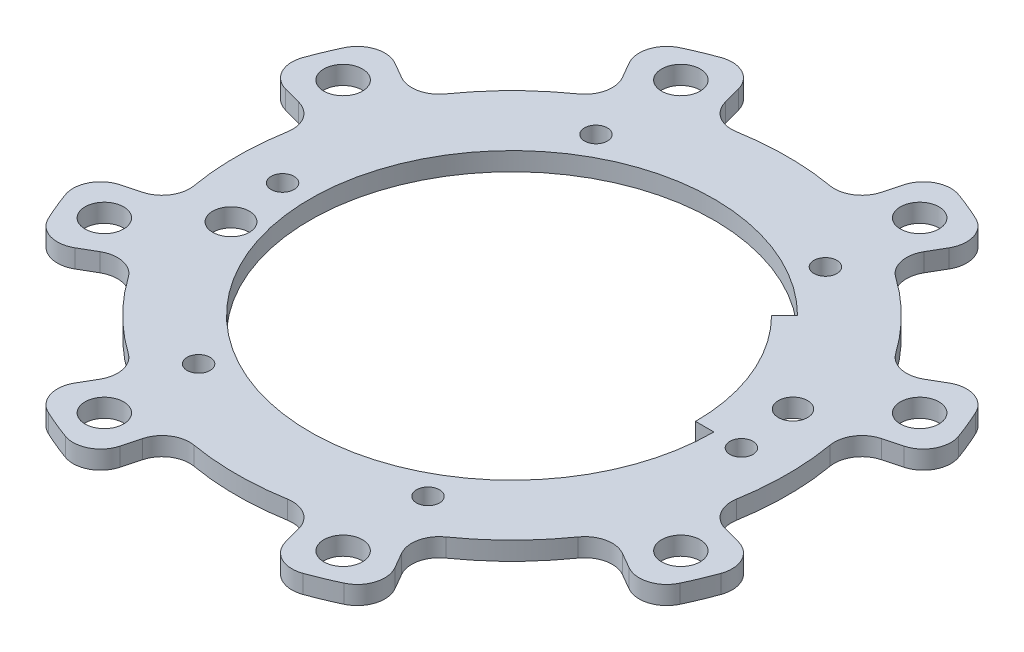
from build123d import *

# Parameters (mm, degrees)
SKETCH_1_R          = 38
SKETCH_1_R_2        = 22
EXTRUDE_1_DEPTH     = 2
SKETCH_2_R          = 2.1
CUT_EXTRUDE_1_DEPTH = 54.777318639
SKETCH_3_R          = 1.25
CUT_EXTRUDE_2_DEPTH = 54.777318639
SKETCH_5_R          = 1.6
SKETCH_5_R_2        = 2
CUT_EXTRUDE_3_DEPTH = 54.777318639
CUT_EXTRUDE_4_DEPTH = 54.777318639
FILLET_1_R          = 3
EXTRUDE_2_DEPTH     = 2


with BuildPart() as part:
    # 草图1 → 凸台-拉伸1 (new body)
    with BuildSketch(Plane(origin=(0, 0, 0), x_dir=(1, 0, 0), z_dir=(0, 1, 0))):
        with Locations(Location((0, 0, 0), (0, 0, 270))):
            Circle(SKETCH_1_R)
        with Locations(Location((0, 0, 0), (0, 0, 270))):
            Circle(SKETCH_1_R_2, mode=Mode.SUBTRACT)
    extrude(amount=EXTRUDE_1_DEPTH)

    # 草图2 → 切除-拉伸1 (cut, through all)
    with BuildSketch(Plane(origin=(0, 2, 0), x_dir=(1, 0, 0), z_dir=(0, 1, 0))):
        with Locations(Location((13.0112367, 31.411904105, 0), (0, 0, 270))):
            Circle(SKETCH_2_R)
        with Locations(Location((31.411904105, 13.0112367, 0), (0, 0, 270))):
            Circle(SKETCH_2_R)
        with Locations(Location((31.411904105, -13.0112367, 0), (0, 0, 270))):
            Circle(SKETCH_2_R)
        with Locations(Location((13.0112367, -31.411904105, 0), (0, 0, 270))):
            Circle(SKETCH_2_R)
        with Locations(Location((-13.0112367, -31.411904105, 0), (0, 0, 270))):
            Circle(SKETCH_2_R)
        with Locations(Location((-31.411904105, -13.0112367, 0), (0, 0, 270))):
            Circle(SKETCH_2_R)
        with Locations(Location((-31.411904105, 13.0112367, 0), (0, 0, 270))):
            Circle(SKETCH_2_R)
        with Locations(Location((-13.0112367, 31.411904105, 0), (0, 0, 270))):
            Circle(SKETCH_2_R)
    extrude(amount=-CUT_EXTRUDE_1_DEPTH, mode=Mode.SUBTRACT)

    # 草图3 → 切除-拉伸2 (cut, through all)
    with BuildSketch(Plane(origin=(0, 2, 0), x_dir=(1, 0, 0), z_dir=(0, 1, 0))):
        with Locations(Location((12.5, 21.650635095, 0), (0, 0, 270))):
            Circle(SKETCH_3_R)
        with Locations(Location((25, 0, 0), (0, 0, 270))):
            Circle(SKETCH_3_R)
        with Locations(Location((12.5, -21.650635095, 0), (0, 0, 270))):
            Circle(SKETCH_3_R)
        with Locations(Location((-12.5, -21.650635095, 0), (0, 0, 270))):
            Circle(SKETCH_3_R)
        with Locations(Location((-25, 0, 0), (0, 0, 270))):
            Circle(SKETCH_3_R)
        with Locations(Location((-12.5, 21.650635095, 0), (0, 0, 270))):
            Circle(SKETCH_3_R)
    extrude(amount=-CUT_EXTRUDE_2_DEPTH, mode=Mode.SUBTRACT)

    # 草图5 → 切除-拉伸3 (cut, through all)
    with BuildSketch(Plane(origin=(0, 2, 0), x_dir=(1, 0, 0), z_dir=(0, 1, 0))):
        with Locations(Location((24.148145657, 6.470476128, 0), (0, 0, 270))):
            Circle(SKETCH_5_R)
        with Locations(Location((-24.148145657, -6.470476128, 0), (0, 0, 270))):
            Circle(SKETCH_5_R_2)
    extrude(amount=-CUT_EXTRUDE_3_DEPTH, mode=Mode.SUBTRACT)

    # 草图6 → 切除-拉伸4 (cut, through all)
    with BuildSketch(Plane(origin=(0, 2, 0), x_dir=(1, 0, 0), z_dir=(0, 1, 0))):
        with BuildLine():
            Line((-15, 25.980762114), (-19, 32.908965344))
            ThreePointArc((-19, 32.908965344), (-26.870057685, 26.870057685), (-32.908965344, 19))
            Line((-32.908965344, 19), (-25.980762114, 15))
            ThreePointArc((-25.980762114, 15), (-21.213203436, 21.213203436), (-15, 25.980762114))
        make_face()
        with BuildLine():
            ThreePointArc((9.835123714, 36.705181399), (4.959995304, 37.674904732), (0, 38))
            Line((0, 38), (0, 30))
            ThreePointArc((0, 30), (3.915785767, 29.743345841), (7.764571353, 28.977774789))
            Line((7.764571353, 28.977774789), (9.835123714, 36.705181399))
        make_face()
        with BuildLine():
            Line((0, 30), (0, 38))
            ThreePointArc((0, 38), (-4.959995304, 37.674904732), (-9.835123714, 36.705181399))
            Line((-9.835123714, 36.705181399), (-7.764571353, 28.977774789))
            ThreePointArc((-7.764571353, 28.977774789), (-3.915785767, 29.743345841), (0, 30))
        make_face()
        with BuildLine():
            ThreePointArc((32.908965344, 19), (26.870057685, 26.870057685), (19, 32.908965344))
            Line((19, 32.908965344), (15, 25.980762114))
            ThreePointArc((15, 25.980762114), (21.213203436, 21.213203436), (25.980762114, 15))
            Line((25.980762114, 15), (32.908965344, 19))
        make_face()
        with BuildLine():
            Line((36.705181399, 9.835123714), (28.977774789, 7.764571353))
            ThreePointArc((28.977774789, 7.764571353), (29.743345841, 3.915785767), (30, 0))
            ThreePointArc((30, 0), (29.743345841, -3.915785767), (28.977774789, -7.764571353))
            Line((28.977774789, -7.764571353), (36.705181399, -9.835123714))
            ThreePointArc((36.705181399, -9.835123714), (37.674904732, -4.959995304), (38, 0))
            ThreePointArc((38, 0), (37.674904732, 4.959995304), (36.705181399, 9.835123714))
        make_face()
        with BuildLine():
            Line((32.908965344, -19), (25.980762114, -15))
            ThreePointArc((25.980762114, -15), (21.213203436, -21.213203436), (15, -25.980762114))
            Line((15, -25.980762114), (19, -32.908965344))
            ThreePointArc((19, -32.908965344), (26.870057685, -26.870057685), (32.908965344, -19))
        make_face()
        with BuildLine():
            Line((9.835123714, -36.705181399), (7.764571353, -28.977774789))
            ThreePointArc((7.764571353, -28.977774789), (0, -30), (-7.764571353, -28.977774789))
            Line((-7.764571353, -28.977774789), (-9.835123714, -36.705181399))
            ThreePointArc((-9.835123714, -36.705181399), (0, -38), (9.835123714, -36.705181399))
        make_face()
        with BuildLine():
            Line((-19, -32.908965344), (-15, -25.980762114))
            ThreePointArc((-15, -25.980762114), (-21.213203436, -21.213203436), (-25.980762114, -15))
            Line((-25.980762114, -15), (-32.908965344, -19))
            ThreePointArc((-32.908965344, -19), (-26.870057685, -26.870057685), (-19, -32.908965344))
        make_face()
        with BuildLine():
            Line((-36.705181399, -9.835123714), (-28.977774789, -7.764571353))
            ThreePointArc((-28.977774789, -7.764571353), (-30, 0), (-28.977774789, 7.764571353))
            Line((-28.977774789, 7.764571353), (-36.705181399, 9.835123714))
            ThreePointArc((-36.705181399, 9.835123714), (-38, 0), (-36.705181399, -9.835123714))
        make_face()
    extrude(amount=-CUT_EXTRUDE_4_DEPTH, mode=Mode.SUBTRACT)

    # 圆角1
    fillet_1_edges = [part.edges().sort_by_distance(p)[0] for p in [
        (-9.835123714, 1, -36.705181399),
        (9.835123714, 1, -36.705181399),
        (7.764571353, 1, -28.977774789),
        (-7.764571353, 1, -28.977774789),
        (25.980762114, 1, -15),
        (15, 1, -25.980762114),
        (19, 1, -32.908965344),
        (32.908965344, 1, -19),
        (28.977774789, 1, 7.764571353),
        (28.977774789, 1, -7.764571353),
        (36.705181399, 1, -9.835123714),
        (36.705181399, 1, 9.835123714),
        (15, 1, 25.980762114),
        (25.980762114, 1, 15),
        (32.908965344, 1, 19),
        (19, 1, 32.908965344),
        (-7.764571353, 1, 28.977774789),
        (7.764571353, 1, 28.977774789),
        (9.835123714, 1, 36.705181399),
        (-9.835123714, 1, 36.705181399),
        (-25.980762114, 1, 15),
        (-15, 1, 25.980762114),
        (-19, 1, 32.908965344),
        (-32.908965344, 1, 19),
        (-28.977774789, 1, -7.764571353),
        (-28.977774789, 1, 7.764571353),
        (-36.705181399, 1, 9.835123714),
        (-36.705181399, 1, -9.835123714),
        (-15, 1, -25.980762114),
        (-25.980762114, 1, -15),
        (-32.908965344, 1, -19),
        (-19, 1, -32.908965344),
    ]]
    fillet(fillet_1_edges, radius=FILLET_1_R)

    # 草图7 → 凸台-拉伸2 (add)
    with BuildSketch(Plane.XZ):
        with BuildLine():
            Line((22, 0), (20, 0))
            ThreePointArc((20, 0), (18.47759065, -7.653668647), (14.142135624, -14.142135624))
            Line((14.142135624, -14.142135624), (15.556349186, -15.556349186))
            ThreePointArc((15.556349186, -15.556349186), (20.325349715, -8.419035512), (22, 0))
        make_face()
    extrude(amount=-EXTRUDE_2_DEPTH)


solid = part.part
